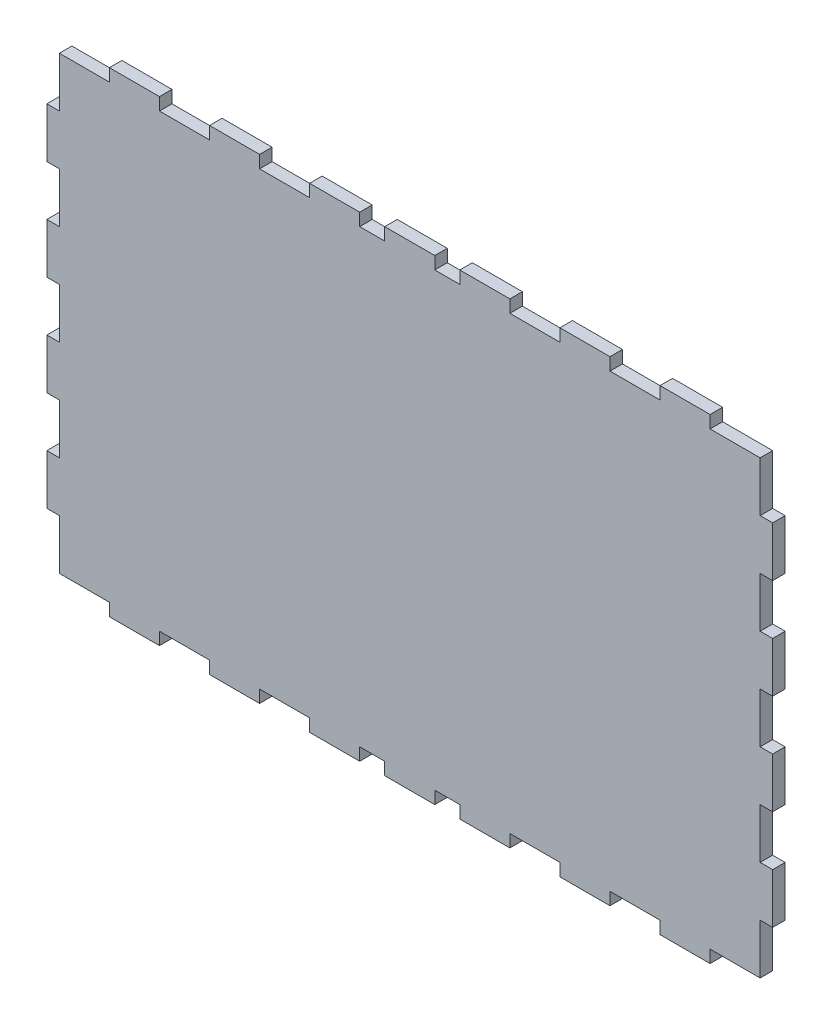
from build123d import *

# Parameters (mm, degrees)
EXTRUDE1_DEPTH = 6.35


with BuildPart() as part:
    # Sketch1 → Extrude1 (new body)
    with BuildSketch(Plane.XY):
        Polygon((164.265587146, 19.289172699), (164.265587146, 25.639172699), (189.665587146, 25.639172699), (189.665587146, 19.289172699), (215.065587146, 19.289172699), (215.065587146, 25.639172699), (240.465587146, 25.639172699), (240.465587146, 19.289172699), (265.865587146, 19.289172699), (265.865587146, 25.639172699), (291.265587146, 25.639172699), (291.265587146, 19.289172699), (303.965587146, 19.289172699), (303.965587146, 25.639172699), (329.365587146, 25.639172699), (329.365587146, 19.289172699), (342.065587146, 19.289172699), (342.065587146, 25.639172699), (367.465587146, 25.639172699), (367.465587146, 19.289172699), (392.865587146, 19.289172699), (392.865587146, 25.639172699), (418.265587146, 25.639172699), (418.265587146, 19.289172699), (443.665587146, 19.289172699), (443.665587146, 25.639172699), (469.065587146, 25.639172699), (469.065587146, 19.289172699), (494.465587146, 19.289172699), (494.465587146, -6.110827301), (500.815587146, -6.110827301), (500.815587146, -31.510827301), (494.465587146, -31.510827301), (494.465587146, -56.910827301), (500.815587146, -56.910827301), (500.815587146, -82.310827301), (494.465587146, -82.310827301), (494.465587146, -107.710827301), (500.815587146, -107.710827301), (500.815587146, -133.110827301), (494.465587146, -133.110827301), (494.465587146, -158.510827301), (500.815587146, -158.510827301), (500.815587146, -183.910827301), (494.465587146, -183.910827301), (494.465587146, -209.310827301), (469.065587146, -209.310827301), (469.065587146, -215.660827301), (443.665587146, -215.660827301), (443.665587146, -209.310827301), (418.265587146, -209.310827301), (418.265587146, -215.660827301), (392.865587146, -215.660827301), (392.865587146, -209.310827301), (367.465587146, -209.310827301), (367.465587146, -215.660827301), (342.065587146, -215.660827301), (342.065587146, -209.310827301), (329.365587146, -209.310827301), (329.365587146, -215.660827301), (303.965587146, -215.660827301), (303.965587146, -209.310827301), (291.265587146, -209.310827301), (291.265587146, -215.660827301), (265.865587146, -215.660827301), (265.865587146, -209.310827301), (240.465587146, -209.310827301), (240.465587146, -215.660827301), (215.065587146, -215.660827301), (215.065587146, -209.310827301), (189.665587146, -209.310827301), (189.665587146, -215.660827301), (164.265587146, -215.660827301), (164.265587146, -209.310827301), (138.865587146, -209.310827301), (138.865587146, -183.910827301), (132.515587146, -183.910827301), (132.515587146, -158.510827301), (138.865587146, -158.510827301), (138.865587146, -133.110827301), (132.515587146, -133.110827301), (132.515587146, -107.710827301), (138.865587146, -107.710827301), (138.865587146, -82.310827301), (132.515587146, -82.310827301), (132.515587146, -56.910827301), (138.865587146, -56.910827301), (138.865587146, -31.510827301), (132.515587146, -31.510827301), (132.515587146, -6.110827301), (138.865587146, -6.110827301), (138.865587146, 19.289172699), align=None)
    extrude(amount=EXTRUDE1_DEPTH)


solid = part.part
